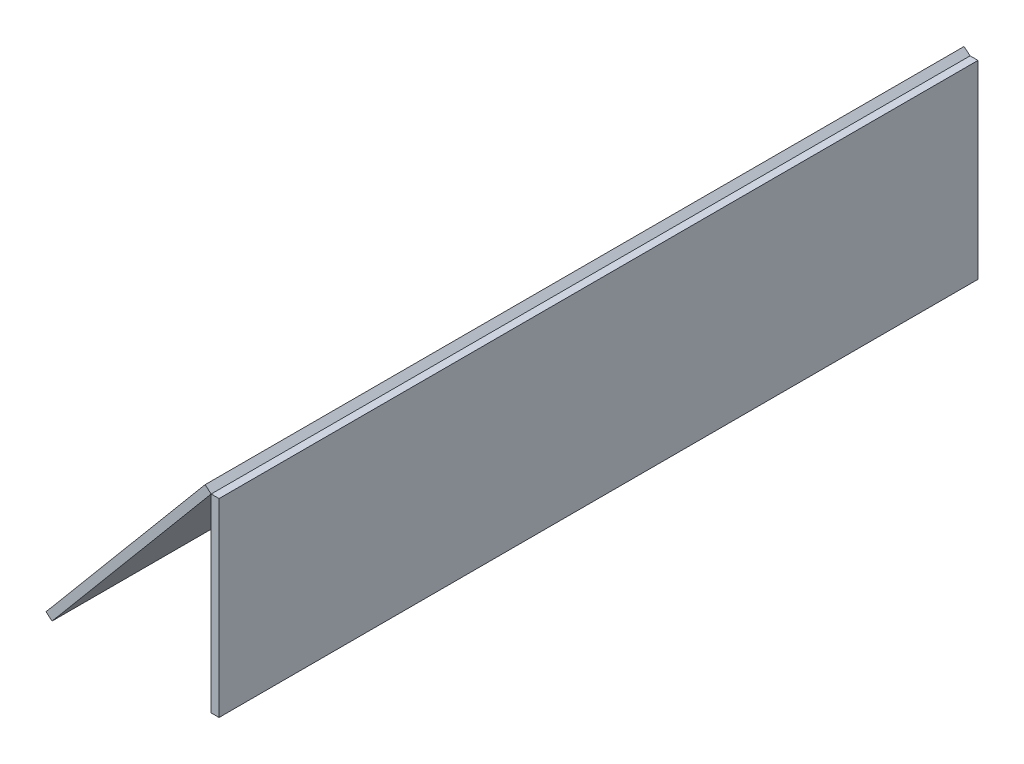
from build123d import *

# Parameters (mm, degrees)
SKETCH1_W           = 610
SKETCH1_H           = 152.4
BOSS_EXTRUDE1_DEPTH = 6.35
BOSS_EXTRUDE2_DEPTH = 610


with BuildPart() as part:
    # Sketch1 → Boss-Extrude1 (new body)
    with BuildSketch(Plane(origin=(0, 0, 0), x_dir=(0, 0, -1), z_dir=(1, 0, 0))):
        Rectangle(SKETCH1_W, SKETCH1_H)
    extrude(amount=BOSS_EXTRUDE1_DEPTH)


with BuildPart() as body_2:
    # Sketch2 → Boss-Extrude2 (new body)
    with BuildSketch(Plane(origin=(0, 0, -305), x_dir=(-1, 0, 0), z_dir=(0, 0, -1))):
        Polygon((0, 76.2), (127.878783791, -76.2), (132.743166005, -72.118298678), (4.864382214, 80.281701322), align=None)
    extrude(amount=-BOSS_EXTRUDE2_DEPTH)


solid = Compound([part.part, body_2.part])
